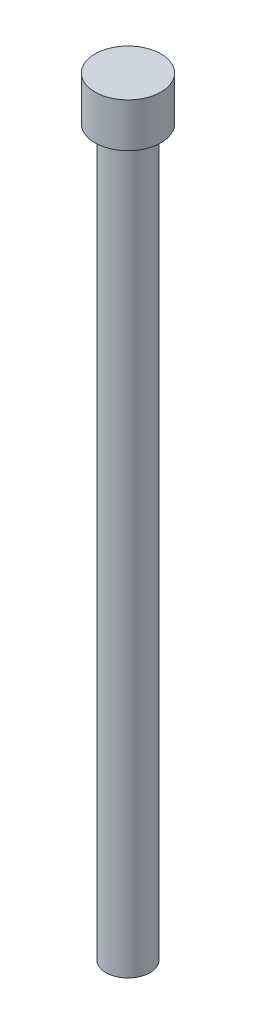
from build123d import *

# Parameters (mm, degrees)
SKETCH_1_R      = 2
EXTRUDE_1_DEPTH = 65.8
SKETCH_2_R      = 3
EXTRUDE_2_DEPTH = 4


with BuildPart() as part:
    # 草图1 → 凸台-拉伸1 (new body)
    with BuildSketch(Plane(origin=(0, 0, 0), x_dir=(1, 0, 0), z_dir=(0, 1, 0))):
        with Locations(Location((0, 0, 0), (0, 0, 270))):
            Circle(SKETCH_1_R)
    extrude(amount=EXTRUDE_1_DEPTH)

    # 草图2 → 凸台-拉伸2 (add)
    with BuildSketch(Plane(origin=(0, 65.8, 0), x_dir=(1, 0, 0), z_dir=(0, 1, 0))):
        with Locations(Location((0, 0, 0), (0, 0, 270))):
            Circle(SKETCH_2_R)
    extrude(amount=EXTRUDE_2_DEPTH)


solid = part.part
